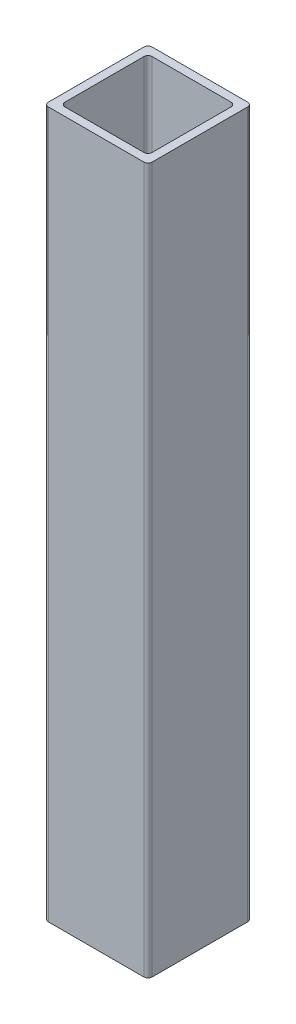
from build123d import *

# Parameters (mm, degrees)
BOSS_EXTRUDE1_DEPTH = 170


with BuildPart() as part:
    # Sketch1 → Boss-Extrude1 (new body)
    with BuildSketch(Plane(origin=(0, 0, 0), x_dir=(1, 0, 0), z_dir=(0, 1, 0))):
        with BuildLine():
            Line((-11.5, -12.5), (11.5, -12.5))
            ThreePointArc((11.5, -12.5), (12.207106781, -12.207106781), (12.5, -11.5))
            Line((12.5, -11.5), (12.5, 11.5))
            ThreePointArc((12.5, 11.5), (12.207106781, 12.207106781), (11.5, 12.5))
            Line((11.5, 12.5), (-11.5, 12.5))
            ThreePointArc((-11.5, 12.5), (-12.207106781, 12.207106781), (-12.5, 11.5))
            Line((-12.5, 11.5), (-12.5, -11.5))
            ThreePointArc((-12.5, -11.5), (-12.207106781, -12.207106781), (-11.5, -12.5))
        make_face()
        with BuildLine():
            Line((-9.5, -10.5), (9.5, -10.5))
            ThreePointArc((9.5, -10.5), (10.207106781, -10.207106781), (10.5, -9.5))
            Line((10.5, -9.5), (10.5, 9.5))
            ThreePointArc((10.5, 9.5), (10.207106781, 10.207106781), (9.5, 10.5))
            Line((9.5, 10.5), (-9.5, 10.5))
            ThreePointArc((-9.5, 10.5), (-10.207106781, 10.207106781), (-10.5, 9.5))
            Line((-10.5, 9.5), (-10.5, -9.5))
            ThreePointArc((-10.5, -9.5), (-10.207106781, -10.207106781), (-9.5, -10.5))
        make_face(mode=Mode.SUBTRACT)
    extrude(amount=BOSS_EXTRUDE1_DEPTH)


solid = part.part
